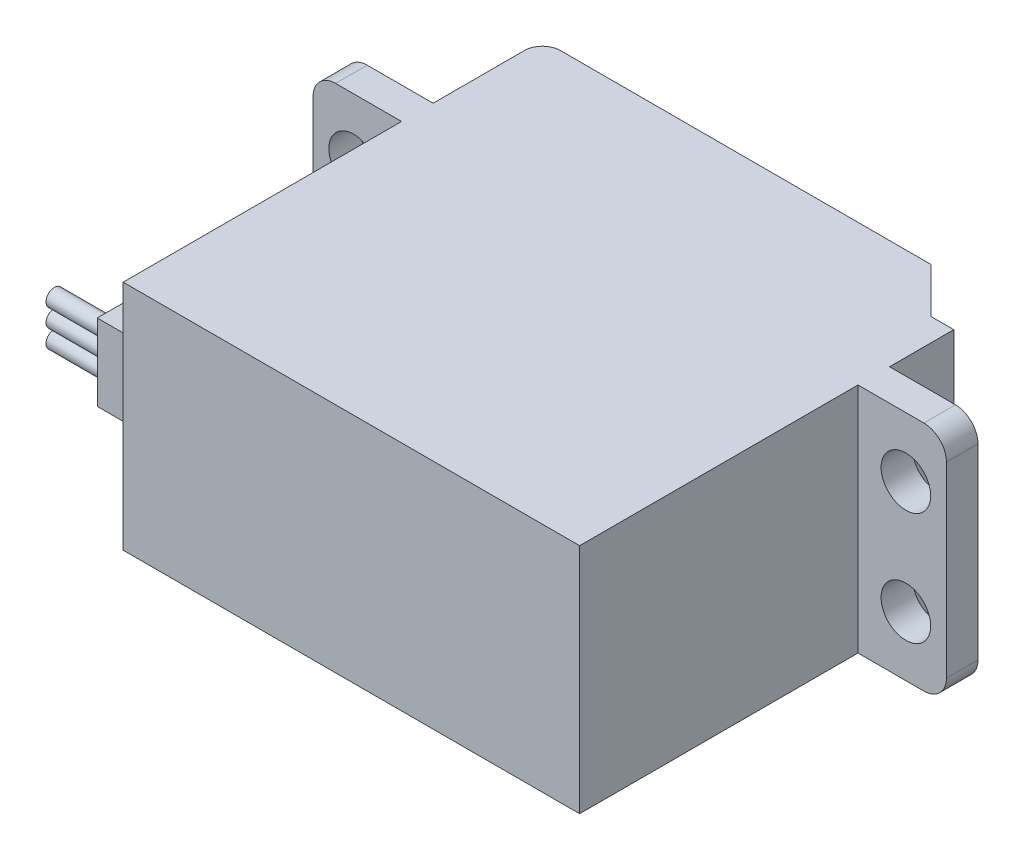
from build123d import *

# Parameters (mm, degrees)
BOSS_EXTRU_1_DEPTH   = 10.3
ESQUISSE3_W          = 7.85
ESQUISSE3_H          = 20.6
ESQUISSE3_R          = 2.2
BOSS_EXTRU_2_DEPTH   = 2.8
BOSS_EXTRU_3_DEPTH   = 0.6
ESQUISSE8_R          = 6.1
BOSS_EXTRU_7_DEPTH   = 0.5
ESQUISSE5_R          = 2.925
BOSS_EXTRU_4_DEPTH   = 3.9
CONG_1_R             = 2
ESQUISSE6_W          = 3
ESQUISSE6_H          = 6.8
BOSS_EXTRU_5_DEPTH   = 5.3
ESQUISSE7_R          = 0.75
BOSS_EXTRU_6_DEPTH   = 5.3
D_GAGEMENT_M31_D     = 3.2
D_GAGEMENT_M31_DEPTH = 6
D_GAGEMENT_M31_TIP   = 0.96137699
CONG_2_R             = 1.6


with BuildPart() as part:
    # Esquisse1 → Boss.-Extru.1 (new, symmetric)
    with BuildSketch(Plane(origin=(0, 0, 0), x_dir=(1, 0, 0), z_dir=(0, 1, 0))):
        Polygon((-20.25, 12.5), (14.25, 12.5), (18.25, 8.5), (20.25, 8.5), (20.25, -24.7), (-20.25, -24.7), align=None)
    extrude(amount=BOSS_EXTRU_1_DEPTH, both=True)

    # Esquisse3 → Boss.-Extru.2 (add)
    # profile 1 of 2: a face of its own
    with BuildSketch(Plane.XY):
        with Locations((24.175, 0)):
            Rectangle(ESQUISSE3_W, ESQUISSE3_H)
        with Locations((24.5, 5)):
            Circle(ESQUISSE3_R, mode=Mode.SUBTRACT)
        with Locations(Location((24.5, -5, 0), (0, 0, 180))):
            Circle(ESQUISSE3_R, mode=Mode.SUBTRACT)
    # profile 2 of 2: a face of its own
    with BuildSketch(Plane.XY):
        with Locations((-24.175, 0)):
            Rectangle(ESQUISSE3_W, ESQUISSE3_H)
        with Locations(Location((-24.5, 5, 0), (0, 0, 180))):
            Circle(ESQUISSE3_R, mode=Mode.SUBTRACT)
        with Locations((-24.5, -5)):
            Circle(ESQUISSE3_R, mode=Mode.SUBTRACT)
    extrude(amount=-BOSS_EXTRU_2_DEPTH)

    # Esquisse4 → Boss.-Extru.3 (add, symmetric)
    with BuildSketch(Plane(origin=(0, 0, 0), x_dir=(1, 0, 0), z_dir=(0, 1, 0))):
        Polygon((20.25, 2.8), (20.25, 3.8), (23.75, 2.8), align=None)
        Polygon((-23.75, 2.8), (-20.25, 3.8), (-20.25, 2.8), align=None)
    extrude(amount=BOSS_EXTRU_3_DEPTH, both=True)

    # Esquisse8 → Boss.-Extru.7 (add)
    with BuildSketch(Plane(origin=(0, 0, -12.5), x_dir=(-1, 0, 0), z_dir=(0, 0, -1))):
        with Locations(Location((10.25, 0, 0), (0, 0, 180))):
            Circle(ESQUISSE8_R)
    extrude(amount=BOSS_EXTRU_7_DEPTH)

    # Esquisse5 → Boss.-Extru.4 (add)
    with BuildSketch(Plane(origin=(0, 0, -13), x_dir=(-1, 0, 0), z_dir=(0, 0, -1))):
        with Locations((10, 0)):
            Circle(ESQUISSE5_R)
    extrude(amount=BOSS_EXTRU_4_DEPTH)

    # Congé1
    cong_1_edges = [part.edges().sort_by_distance(p)[0] for p in [
        (28.1, 10.3, -1.4),
        (28.1, -10.3, -1.4),
        (-28.1, -10.3, -1.4),
        (-28.1, 10.3, -1.4),
    ]]
    fillet(cong_1_edges, radius=CONG_1_R)

    # Esquisse6 → Boss.-Extru.5 (add)
    with BuildSketch(Plane.ZY.offset(20.25)):
        with Locations((20.2, 0)):
            Rectangle(ESQUISSE6_W, ESQUISSE6_H)
    extrude(amount=BOSS_EXTRU_5_DEPTH)

    # Esquisse7 → Boss.-Extru.6 (add)
    with BuildSketch(Plane.ZY.offset(25.55)):
        with Locations((20.2, 0)):
            Circle(ESQUISSE7_R)
        with Locations((20.2, 1.6)):
            Circle(ESQUISSE7_R)
        with Locations(Location((20.2, -1.6, 0), (0, 0, 180))):
            Circle(ESQUISSE7_R)
    extrude(amount=BOSS_EXTRU_6_DEPTH)

    # Dégagement M31
    with Locations(Plane(origin=(0, 0, -16.9), x_dir=(-1, 0, 0), z_dir=(0, 0, -1))):
        with Locations((10, 0)):
            Hole(D_GAGEMENT_M31_D / 2, depth=D_GAGEMENT_M31_DEPTH)
            with Locations((0, 0, -(D_GAGEMENT_M31_DEPTH + D_GAGEMENT_M31_TIP / 2))):  # 118° drill point
                Cone(0, D_GAGEMENT_M31_D / 2, D_GAGEMENT_M31_TIP, mode=Mode.SUBTRACT)

    # Congé2
    cong_2_edges = [part.edges().sort_by_distance(p)[0] for p in [
        (-20.25, 0, -12.5),
    ]]
    fillet(cong_2_edges, radius=CONG_2_R)


solid = part.part
